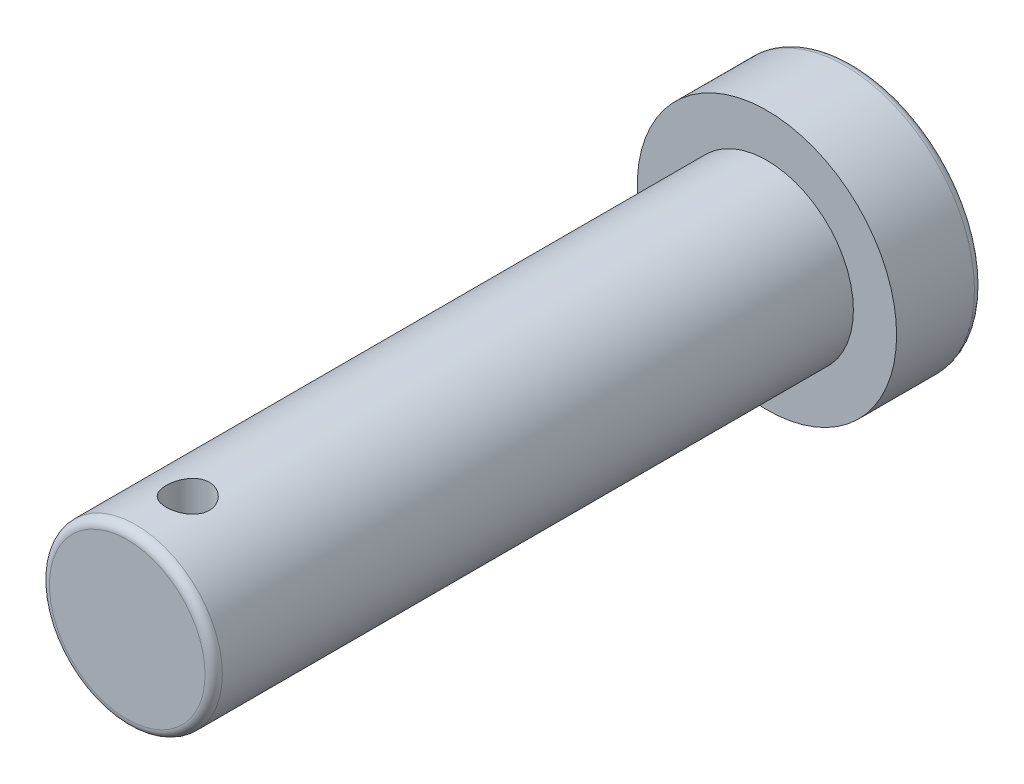
from build123d import *

# Parameters (mm, degrees)
SKETCH1_R               = 15
BOSS_EXTRUDE1_DEPTH     = 10
SKETCH2_R               = 10
BOSS_EXTRUDE2_DEPTH     = 74
CUT_EXTRUDE1_DEPTH      = 74
CUT_EXTRUDE1_DEPTH_BACK = 74
SKETCH3_R               = 2.5
FILLET1_R               = 1
FILLET2_R               = 1


with BuildPart() as part:
    # Sketch1 → Boss-Extrude1 (new body)
    with BuildSketch(Plane.XY):
        Circle(SKETCH1_R)
    extrude(amount=BOSS_EXTRUDE1_DEPTH)

    # Sketch2 → Boss-Extrude2 (add)
    with BuildSketch(Plane.XY.offset(10)):
        Circle(SKETCH2_R)
    extrude(amount=BOSS_EXTRUDE2_DEPTH)

    # Sketch3 → Cut-Extrude1 (cut, two sides: drawn at the far end of the back side and taken through both)
    with BuildSketch(Plane(origin=(0, 0, 0), x_dir=(1, 0, 0), z_dir=(0, 1, 0)).offset(-CUT_EXTRUDE1_DEPTH_BACK)):
        with Locations((0, -77)):
            Circle(SKETCH3_R)
    extrude(amount=CUT_EXTRUDE1_DEPTH + CUT_EXTRUDE1_DEPTH_BACK, mode=Mode.SUBTRACT)

    # Fillet1
    fillet1_edges = [part.edges().sort_by_distance(p)[0] for p in [
        (-15, 0, 0),
    ]]
    fillet(fillet1_edges, radius=FILLET1_R)

    # Fillet2
    fillet2_edges = [part.edges().sort_by_distance(p)[0] for p in [
        (-10, 0, 84),
    ]]
    fillet(fillet2_edges, radius=FILLET2_R)


solid = part.part
